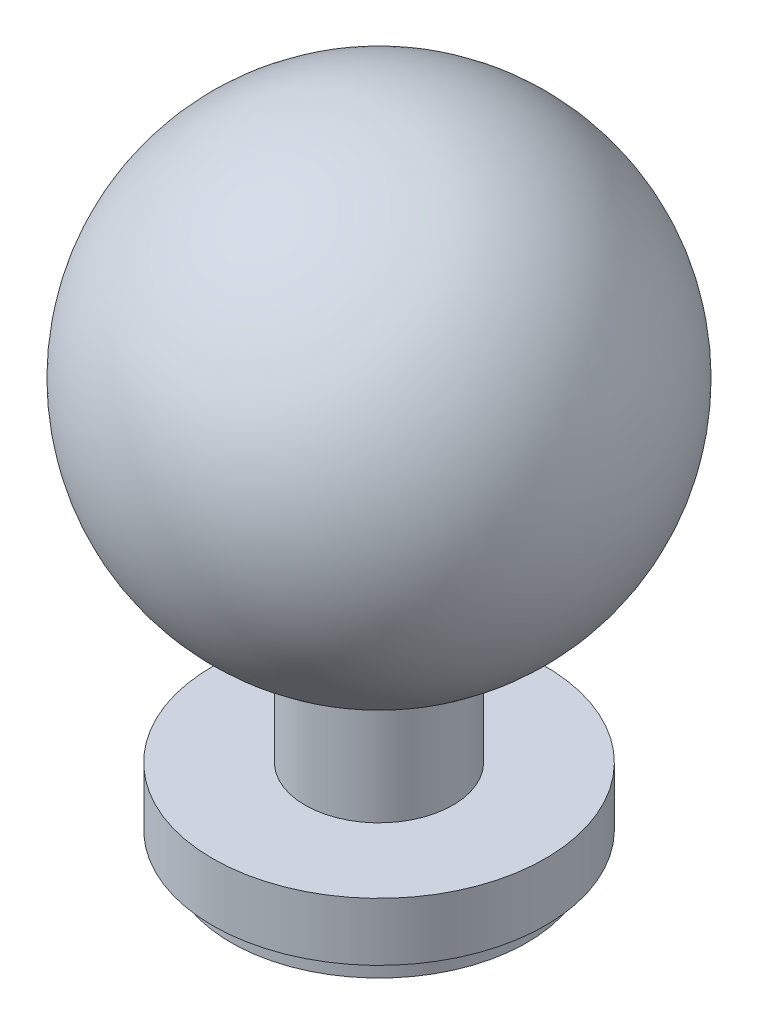
from build123d import *

# Parameters (mm, degrees)
SKETCH1_R           = 4.5
BOSS_EXTRUDE1_DEPTH = 1.57
SKETCH2_R           = 2
BOSS_EXTRUDE2_DEPTH = 9
SKETCH4_R           = 4
BOSS_EXTRUDE3_DEPTH = 0.65


with BuildPart() as part:
    # Sketch1 → Boss-Extrude1 (new body)
    with BuildSketch(Plane(origin=(0, 0, 0), x_dir=(1, 0, 0), z_dir=(0, 1, 0))):
        with Locations(Location((0, 0, 0), (0, 0, 270))):
            Circle(SKETCH1_R)
    extrude(amount=BOSS_EXTRUDE1_DEPTH)

    # Sketch2 → Boss-Extrude2 (add)
    with BuildSketch(Plane(origin=(0, 1.57, 0), x_dir=(1, 0, 0), z_dir=(0, 1, 0))):
        with Locations(Location((0, 0, 0), (0, 0, 270))):
            Circle(SKETCH2_R)
    extrude(amount=BOSS_EXTRUDE2_DEPTH)

    # Sketch3 → Revolve1 (revolve)
    with BuildSketch(Plane(origin=(0, 10.57, 0), x_dir=(1, 0, 0), z_dir=(0, 1, 0))):
        with BuildLine():
            Line((0, 6.35), (0, -6.35))
            ThreePointArc((0, -6.35), (6.35, 0), (0, 6.35))
        make_face()
    revolve(axis=Axis((0, 10.57, -8.311953328), (0, 0, 1)))

    # Sketch4 → Boss-Extrude3 (add)
    with BuildSketch(Plane.XZ):
        with Locations(Location((0, 0, 0), (0, 0, 270))):
            Circle(SKETCH4_R)
    extrude(amount=BOSS_EXTRUDE3_DEPTH)


solid = part.part
